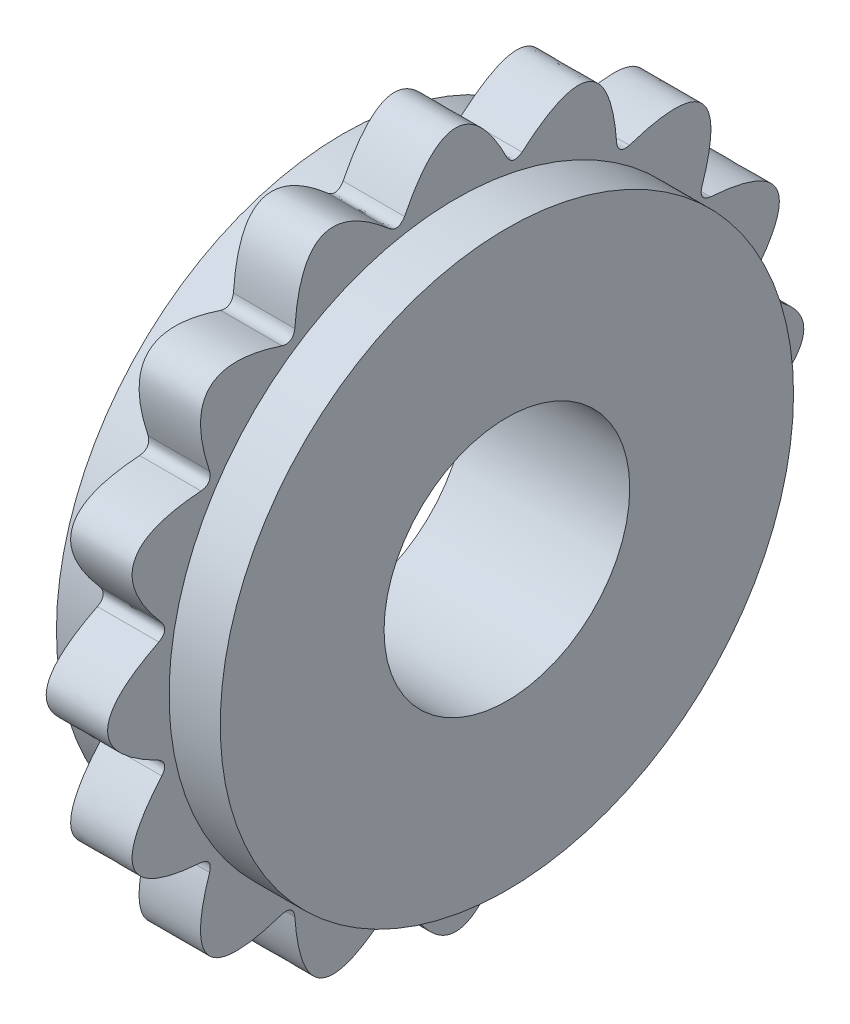
from build123d import *

# Parameters (mm, degrees)
BOSS_EXTRUDE1_DEPTH = 3
SKETCH2_R           = 14
BOSS_EXTRUDE2_DEPTH = 2.5
BOSS_EXTRUDE3_START = 2.5
SKETCH3_R           = 14
BOSS_EXTRUDE3_DEPTH = 2.5
SKETCH4_R           = 6
CUT_EXTRUDE1_DEPTH  = 22.5


with BuildPart() as part:
    # Sketch1 → Boss-Extrude1 (new body)
    with BuildSketch(Plane(origin=(0, 0, 0), x_dir=(0, 0, -1), z_dir=(1, 0, 0))):
        with BuildLine():
            ThreePointArc((14.228335163, -2.793649671), (14.431923986, -1.403413719), (14.5, 0))
            ThreePointArc((14.5, 0), (14.431119126, 1.411665951), (14.22513093, 2.809919933))
            add(Edge.make_bspline(
                [(14.214351084, 2.863952385), (14.217519172, 2.836587161), (14.22513093, 2.809919933)],
                knots=[0.463705523, 0.463705523, 0.463705523, 0.536806911, 0.536806911, 0.536806911], degree=2))
            ThreePointArc((14.214351084, 2.863952385), (13.393078054, 5.556569107), (12.066997509, 8.039749444))
            add(Edge.make_bspline(
                [(12.036360906, 8.085543652), (12.049760055, 8.061473856), (12.066997509, 8.039749444)],
                knots=[0.463705523, 0.463705523, 0.463705523, 0.536806911, 0.536806911, 0.536806911], degree=2))
            ThreePointArc((12.036360906, 8.085543652), (10.247183754, 10.258909548), (8.071773105, 12.045599983))
            add(Edge.make_bspline(
                [(8.025943889, 12.076184194), (8.047534202, 12.059074235), (8.071773105, 12.045599983)],
                knots=[0.463705523, 0.463705523, 0.463705523, 0.536806911, 0.536806911, 0.536806911], degree=2))
            ThreePointArc((8.025943889, 12.076184194), (5.541248618, 13.399424008), (2.847694416, 14.217617118))
            add(Edge.make_bspline(
                [(2.793649671, 14.228335163), (2.820144217, 14.220789877), (2.847694416, 14.217617118)],
                knots=[0.463705523, 0.463705523, 0.463705523, 0.536806911, 0.536806911, 0.536806911], degree=2))
            ThreePointArc((2.793649671, 14.228335163), (-0.008291389, 14.499997629), (-2.809919933, 14.22513093))
            add(Edge.make_bspline(
                [(-2.863952385, 14.214351084), (-2.836587161, 14.217519172), (-2.809919933, 14.22513093)],
                knots=[0.463705523, 0.463705523, 0.463705523, 0.536806911, 0.536806911, 0.536806911], degree=2))
            ThreePointArc((-2.863952385, 14.214351084), (-5.556569107, 13.393078054), (-8.039749444, 12.066997509))
            add(Edge.make_bspline(
                [(-8.085543652, 12.036360906), (-8.061473856, 12.049760055), (-8.039749444, 12.066997509)],
                knots=[0.463705523, 0.463705523, 0.463705523, 0.536806911, 0.536806911, 0.536806911], degree=2))
            ThreePointArc((-8.085543652, 12.036360906), (-10.258909548, 10.247183754), (-12.045599983, 8.071773105))
            add(Edge.make_bspline(
                [(-12.076184194, 8.025943889), (-12.059074235, 8.047534202), (-12.045599983, 8.071773105)],
                knots=[0.463705523, 0.463705523, 0.463705523, 0.536806911, 0.536806911, 0.536806911], degree=2))
            ThreePointArc((-12.076184194, 8.025943889), (-13.399424008, 5.541248618), (-14.217617118, 2.847694416))
            add(Edge.make_bspline(
                [(-14.228335163, 2.793649671), (-14.220789877, 2.820144217), (-14.217617118, 2.847694416)],
                knots=[0.463705523, 0.463705523, 0.463705523, 0.536806911, 0.536806911, 0.536806911], degree=2))
            ThreePointArc((-14.228335163, 2.793649671), (-14.499997629, -0.008291389), (-14.22513093, -2.809919933))
            add(Edge.make_bspline(
                [(-14.214351084, -2.863952385), (-14.217519172, -2.836587161), (-14.22513093, -2.809919933)],
                knots=[0.463705523, 0.463705523, 0.463705523, 0.536806911, 0.536806911, 0.536806911], degree=2))
            ThreePointArc((-14.214351084, -2.863952385), (-13.393078054, -5.556569107), (-12.066997509, -8.039749444))
            add(Edge.make_bspline(
                [(-12.036360906, -8.085543652), (-12.049760055, -8.061473856), (-12.066997509, -8.039749444)],
                knots=[0.463705523, 0.463705523, 0.463705523, 0.536806911, 0.536806911, 0.536806911], degree=2))
            ThreePointArc((-12.036360906, -8.085543652), (-10.247183754, -10.258909548), (-8.071773105, -12.045599983))
            add(Edge.make_bspline(
                [(-8.025943889, -12.076184194), (-8.047534202, -12.059074235), (-8.071773105, -12.045599983)],
                knots=[0.463705523, 0.463705523, 0.463705523, 0.536806911, 0.536806911, 0.536806911], degree=2))
            ThreePointArc((-8.025943889, -12.076184194), (-5.541248618, -13.399424008), (-2.847694416, -14.217617118))
            add(Edge.make_bspline(
                [(-2.793649671, -14.228335163), (-2.820144217, -14.220789877), (-2.847694416, -14.217617118)],
                knots=[0.463705523, 0.463705523, 0.463705523, 0.536806911, 0.536806911, 0.536806911], degree=2))
            ThreePointArc((-2.793649671, -14.228335163), (0.008291389, -14.499997629), (2.809919933, -14.22513093))
            add(Edge.make_bspline(
                [(2.863952385, -14.214351084), (2.836587161, -14.217519172), (2.809919933, -14.22513093)],
                knots=[0.463705523, 0.463705523, 0.463705523, 0.536806911, 0.536806911, 0.536806911], degree=2))
            ThreePointArc((2.863952385, -14.214351084), (5.556569107, -13.393078054), (8.039749444, -12.066997509))
            add(Edge.make_bspline(
                [(8.085543652, -12.036360906), (8.061473856, -12.049760055), (8.039749444, -12.066997509)],
                knots=[0.463705523, 0.463705523, 0.463705523, 0.536806911, 0.536806911, 0.536806911], degree=2))
            ThreePointArc((8.085543652, -12.036360906), (10.258909548, -10.247183754), (12.045599983, -8.071773105))
            add(Edge.make_bspline(
                [(12.076184194, -8.025943889), (12.059074235, -8.047534202), (12.045599983, -8.071773105)],
                knots=[0.463705523, 0.463705523, 0.463705523, 0.536806911, 0.536806911, 0.536806911], degree=2))
            ThreePointArc((12.076184194, -8.025943889), (13.399424008, -5.541248618), (14.217617118, -2.847694416))
            add(Edge.make_bspline(
                [(14.228335163, -2.793649671), (14.220789877, -2.820144217), (14.217617118, -2.847694416)],
                knots=[0.463705523, 0.463705523, 0.463705523, 0.536806911, 0.536806911, 0.536806911], degree=2))
        make_face()
        with BuildLine():
            ThreePointArc((8.071773105, 12.045599983), (10.247183754, 10.258909548), (12.036360906, 8.085543652))
            add(Edge.make_bspline(
                [(12.02081528, 8.485281374), (11.951365806, 8.23822608), (12.036360906, 8.085543652)],
                knots=[0, 0, 0, 0.463705523, 0.463705523, 0.463705523], degree=2))
            add(Edge.make_bspline(
                [(8.485281374, 12.02081528), (13.788582233, 13.788582233), (12.02081528, 8.485281374)],
                knots=[0, 0, 0, 1, 1, 1], degree=2))
            add(Edge.make_bspline(
                [(8.071773105, 12.045599983), (8.225358323, 11.960222938), (8.485281374, 12.02081528)],
                knots=[0.536806911, 0.536806911, 0.536806911, 1, 1, 1], degree=2))
        make_face()
        with BuildLine():
            ThreePointArc((12.066997509, 8.039749444), (13.393078054, 5.556569107), (14.214351084, 2.863952385))
            add(Edge.make_bspline(
                [(14.352961802, 3.239210938), (14.194254886, 3.037538771), (14.214351084, 2.863952385)],
                knots=[0, 0, 0, 0.463705523, 0.463705523, 0.463705523], degree=2))
            add(Edge.make_bspline(
                [(12.439544641, 7.858608601), (18.015650884, 7.462326931), (14.352961802, 3.239210938)],
                knots=[0, 0, 0, 1, 1, 1], degree=2))
            add(Edge.make_bspline(
                [(12.066997509, 8.039749444), (12.176219368, 7.902096821), (12.439544641, 7.858608601)],
                knots=[0.536806911, 0.536806911, 0.536806911, 1, 1, 1], degree=2))
        make_face()
        with BuildLine():
            ThreePointArc((14.22513093, 2.809919933), (14.431119126, 1.411665951), (14.5, 0))
            ThreePointArc((14.5, 0), (14.431923986, -1.403413719), (14.228335163, -2.793649671))
            add(Edge.make_bspline(
                [(14.5, -2.5), (14.276197331, -2.62558628), (14.228335163, -2.793649671)],
                knots=[0, 0, 0, 0.463705523, 0.463705523, 0.463705523], degree=2))
            add(Edge.make_bspline(
                [(14.5, 2.5), (19.5, 0), (14.5, -2.5)],
                knots=[0, 0, 0, 1, 1, 1], degree=2))
            add(Edge.make_bspline(
                [(14.22513093, 2.809919933), (14.273361391, 2.640948096), (14.5, 2.5)],
                knots=[0.536806911, 0.536806911, 0.536806911, 1, 1, 1], degree=2))
        make_face()
        with BuildLine():
            add(Edge.make_bspline(
                [(14.217617118, -2.847694416), (14.197513532, -3.022261036), (14.352961802, -3.239210938)],
                knots=[0.536806911, 0.536806911, 0.536806911, 1, 1, 1], degree=2))
            ThreePointArc((14.217617118, -2.847694416), (13.399424008, -5.541248618), (12.076184194, -8.025943889))
            add(Edge.make_bspline(
                [(12.439544641, -7.858608601), (12.184718147, -7.888989621), (12.076184194, -8.025943889)],
                knots=[0, 0, 0, 0.463705523, 0.463705523, 0.463705523], degree=2))
            add(Edge.make_bspline(
                [(14.352961802, -3.239210938), (18.015650884, -7.462326931), (12.439544641, -7.858608601)],
                knots=[0, 0, 0, 1, 1, 1], degree=2))
        make_face()
        with BuildLine():
            ThreePointArc((2.847694416, 14.217617118), (5.541248618, 13.399424008), (8.025943889, 12.076184194))
            add(Edge.make_bspline(
                [(7.858608601, 12.439544641), (7.888989621, 12.184718147), (8.025943889, 12.076184194)],
                knots=[0, 0, 0, 0.463705523, 0.463705523, 0.463705523], degree=2))
            add(Edge.make_bspline(
                [(3.239210938, 14.352961802), (7.462326931, 18.015650884), (7.858608601, 12.439544641)],
                knots=[0, 0, 0, 1, 1, 1], degree=2))
            add(Edge.make_bspline(
                [(2.847694416, 14.217617118), (3.022261036, 14.197513532), (3.239210938, 14.352961802)],
                knots=[0.536806911, 0.536806911, 0.536806911, 1, 1, 1], degree=2))
        make_face()
        with BuildLine():
            ThreePointArc((-2.809919933, 14.22513093), (-0.008291389, 14.499997629), (2.793649671, 14.228335163))
            add(Edge.make_bspline(
                [(2.5, 14.5), (2.62558628, 14.276197331), (2.793649671, 14.228335163)],
                knots=[0, 0, 0, 0.463705523, 0.463705523, 0.463705523], degree=2))
            add(Edge.make_bspline(
                [(-2.5, 14.5), (0, 19.5), (2.5, 14.5)],
                knots=[0, 0, 0, 1, 1, 1], degree=2))
            add(Edge.make_bspline(
                [(-2.809919933, 14.22513093), (-2.640948096, 14.273361391), (-2.5, 14.5)],
                knots=[0.536806911, 0.536806911, 0.536806911, 1, 1, 1], degree=2))
        make_face()
        with BuildLine():
            ThreePointArc((-12.045599983, 8.071773105), (-10.258909548, 10.247183754), (-8.085543652, 12.036360906))
            add(Edge.make_bspline(
                [(-8.485281374, 12.02081528), (-8.23822608, 11.951365806), (-8.085543652, 12.036360906)],
                knots=[0, 0, 0, 0.463705523, 0.463705523, 0.463705523], degree=2))
            add(Edge.make_bspline(
                [(-12.02081528, 8.485281374), (-13.788582233, 13.788582233), (-8.485281374, 12.02081528)],
                knots=[0, 0, 0, 1, 1, 1], degree=2))
            add(Edge.make_bspline(
                [(-12.045599983, 8.071773105), (-11.960222938, 8.225358323), (-12.02081528, 8.485281374)],
                knots=[0.536806911, 0.536806911, 0.536806911, 1, 1, 1], degree=2))
        make_face()
        with BuildLine():
            ThreePointArc((-14.217617118, 2.847694416), (-13.399424008, 5.541248618), (-12.076184194, 8.025943889))
            add(Edge.make_bspline(
                [(-12.439544641, 7.858608601), (-12.184718147, 7.888989621), (-12.076184194, 8.025943889)],
                knots=[0, 0, 0, 0.463705523, 0.463705523, 0.463705523], degree=2))
            add(Edge.make_bspline(
                [(-14.352961802, 3.239210938), (-18.015650884, 7.462326931), (-12.439544641, 7.858608601)],
                knots=[0, 0, 0, 1, 1, 1], degree=2))
            add(Edge.make_bspline(
                [(-14.217617118, 2.847694416), (-14.197513532, 3.022261036), (-14.352961802, 3.239210938)],
                knots=[0.536806911, 0.536806911, 0.536806911, 1, 1, 1], degree=2))
        make_face()
        with BuildLine():
            ThreePointArc((-14.22513093, -2.809919933), (-14.499997629, -0.008291389), (-14.228335163, 2.793649671))
            add(Edge.make_bspline(
                [(-14.5, 2.5), (-14.276197331, 2.62558628), (-14.228335163, 2.793649671)],
                knots=[0, 0, 0, 0.463705523, 0.463705523, 0.463705523], degree=2))
            add(Edge.make_bspline(
                [(-14.5, -2.5), (-19.5, 0), (-14.5, 2.5)],
                knots=[0, 0, 0, 1, 1, 1], degree=2))
            add(Edge.make_bspline(
                [(-14.22513093, -2.809919933), (-14.273361391, -2.640948096), (-14.5, -2.5)],
                knots=[0.536806911, 0.536806911, 0.536806911, 1, 1, 1], degree=2))
        make_face()
        with BuildLine():
            add(Edge.make_bspline(
                [(-12.066997509, -8.039749444), (-12.176219368, -7.902096821), (-12.439544641, -7.858608601)],
                knots=[0.536806911, 0.536806911, 0.536806911, 1, 1, 1], degree=2))
            ThreePointArc((-12.066997509, -8.039749444), (-13.393078054, -5.556569107), (-14.214351084, -2.863952385))
            add(Edge.make_bspline(
                [(-14.352961802, -3.239210938), (-14.194254886, -3.037538771), (-14.214351084, -2.863952385)],
                knots=[0, 0, 0, 0.463705523, 0.463705523, 0.463705523], degree=2))
            add(Edge.make_bspline(
                [(-12.439544641, -7.858608601), (-18.015650884, -7.462326931), (-14.352961802, -3.239210938)],
                knots=[0, 0, 0, 1, 1, 1], degree=2))
        make_face()
        with BuildLine():
            add(Edge.make_bspline(
                [(-8.071773105, -12.045599983), (-8.225358323, -11.960222938), (-8.485281374, -12.02081528)],
                knots=[0.536806911, 0.536806911, 0.536806911, 1, 1, 1], degree=2))
            ThreePointArc((-8.071773105, -12.045599983), (-10.247183754, -10.258909548), (-12.036360906, -8.085543652))
            add(Edge.make_bspline(
                [(-12.02081528, -8.485281374), (-11.951365806, -8.23822608), (-12.036360906, -8.085543652)],
                knots=[0, 0, 0, 0.463705523, 0.463705523, 0.463705523], degree=2))
            add(Edge.make_bspline(
                [(-8.485281374, -12.02081528), (-13.788582233, -13.788582233), (-12.02081528, -8.485281374)],
                knots=[0, 0, 0, 1, 1, 1], degree=2))
        make_face()
        with BuildLine():
            add(Edge.make_bspline(
                [(-2.847694416, -14.217617118), (-3.022261036, -14.197513532), (-3.239210938, -14.352961802)],
                knots=[0.536806911, 0.536806911, 0.536806911, 1, 1, 1], degree=2))
            ThreePointArc((-2.847694416, -14.217617118), (-5.541248618, -13.399424008), (-8.025943889, -12.076184194))
            add(Edge.make_bspline(
                [(-7.858608601, -12.439544641), (-7.888989621, -12.184718147), (-8.025943889, -12.076184194)],
                knots=[0, 0, 0, 0.463705523, 0.463705523, 0.463705523], degree=2))
            add(Edge.make_bspline(
                [(-3.239210938, -14.352961802), (-7.462326931, -18.015650884), (-7.858608601, -12.439544641)],
                knots=[0, 0, 0, 1, 1, 1], degree=2))
        make_face()
        with BuildLine():
            add(Edge.make_bspline(
                [(2.809919933, -14.22513093), (2.640948096, -14.273361391), (2.5, -14.5)],
                knots=[0.536806911, 0.536806911, 0.536806911, 1, 1, 1], degree=2))
            ThreePointArc((2.809919933, -14.22513093), (0.008291389, -14.499997629), (-2.793649671, -14.228335163))
            add(Edge.make_bspline(
                [(-2.5, -14.5), (-2.62558628, -14.276197331), (-2.793649671, -14.228335163)],
                knots=[0, 0, 0, 0.463705523, 0.463705523, 0.463705523], degree=2))
            add(Edge.make_bspline(
                [(2.5, -14.5), (0, -19.5), (-2.5, -14.5)],
                knots=[0, 0, 0, 1, 1, 1], degree=2))
        make_face()
        with BuildLine():
            add(Edge.make_bspline(
                [(8.039749444, -12.066997509), (7.902096821, -12.176219368), (7.858608601, -12.439544641)],
                knots=[0.536806911, 0.536806911, 0.536806911, 1, 1, 1], degree=2))
            ThreePointArc((8.039749444, -12.066997509), (5.556569107, -13.393078054), (2.863952385, -14.214351084))
            add(Edge.make_bspline(
                [(3.239210938, -14.352961802), (3.037538771, -14.194254886), (2.863952385, -14.214351084)],
                knots=[0, 0, 0, 0.463705523, 0.463705523, 0.463705523], degree=2))
            add(Edge.make_bspline(
                [(7.858608601, -12.439544641), (7.462326931, -18.015650884), (3.239210938, -14.352961802)],
                knots=[0, 0, 0, 1, 1, 1], degree=2))
        make_face()
        with BuildLine():
            add(Edge.make_bspline(
                [(12.045599983, -8.071773105), (11.960222938, -8.225358323), (12.02081528, -8.485281374)],
                knots=[0.536806911, 0.536806911, 0.536806911, 1, 1, 1], degree=2))
            ThreePointArc((12.045599983, -8.071773105), (10.258909548, -10.247183754), (8.085543652, -12.036360906))
            add(Edge.make_bspline(
                [(8.485281374, -12.02081528), (8.23822608, -11.951365806), (8.085543652, -12.036360906)],
                knots=[0, 0, 0, 0.463705523, 0.463705523, 0.463705523], degree=2))
            add(Edge.make_bspline(
                [(12.02081528, -8.485281374), (13.788582233, -13.788582233), (8.485281374, -12.02081528)],
                knots=[0, 0, 0, 1, 1, 1], degree=2))
        make_face()
        with BuildLine():
            ThreePointArc((-8.039749444, 12.066997509), (-5.556569107, 13.393078054), (-2.863952385, 14.214351084))
            add(Edge.make_bspline(
                [(-3.239210938, 14.352961802), (-3.037538771, 14.194254886), (-2.863952385, 14.214351084)],
                knots=[0, 0, 0, 0.463705523, 0.463705523, 0.463705523], degree=2))
            add(Edge.make_bspline(
                [(-7.858608601, 12.439544641), (-7.462326931, 18.015650884), (-3.239210938, 14.352961802)],
                knots=[0, 0, 0, 1, 1, 1], degree=2))
            add(Edge.make_bspline(
                [(-8.039749444, 12.066997509), (-7.902096821, 12.176219368), (-7.858608601, 12.439544641)],
                knots=[0.536806911, 0.536806911, 0.536806911, 1, 1, 1], degree=2))
        make_face()
    extrude(amount=BOSS_EXTRUDE1_DEPTH)

    # Sketch2 → Boss-Extrude2 (add)
    with BuildSketch(Plane.ZY):
        with Locations(Location((0, 0, 0), (0, 0, 180))):
            Circle(SKETCH2_R)
    extrude(amount=BOSS_EXTRUDE2_DEPTH)

    # Sketch3 → Boss-Extrude3 (add)
    with BuildSketch(Plane(origin=(3, 0, 0), x_dir=(0, 0, -1), z_dir=(1, 0, 0)).offset(BOSS_EXTRUDE3_START)):
        Circle(SKETCH3_R)
    extrude(amount=-BOSS_EXTRUDE3_DEPTH)

    # Sketch4 → Cut-Extrude1 (cut)
    with BuildSketch(Plane(origin=(5.5, 0, 0), x_dir=(0, 0, -1), z_dir=(1, 0, 0))):
        Circle(SKETCH4_R)
    extrude(amount=-CUT_EXTRUDE1_DEPTH, mode=Mode.SUBTRACT)


solid = part.part
